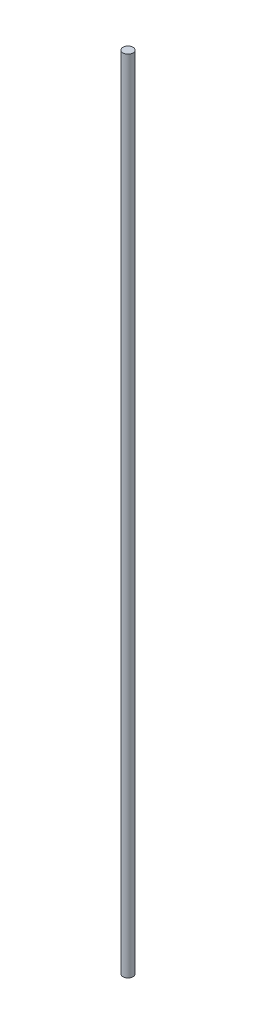
from build123d import *

# Parameters (mm, degrees)
ESQUISSE1_R        = 2.5
BOSS_EXTRU_1_DEPTH = 400


with BuildPart() as part:
    # Esquisse1 → Boss.-Extru.1 (new body)
    with BuildSketch(Plane(origin=(0, 0, 0), x_dir=(1, 0, 0), z_dir=(0, 1, 0))):
        with Locations(Location((0, 0, 0), (0, 0, 270))):
            Circle(ESQUISSE1_R)
    extrude(amount=BOSS_EXTRU_1_DEPTH)


solid = part.part
